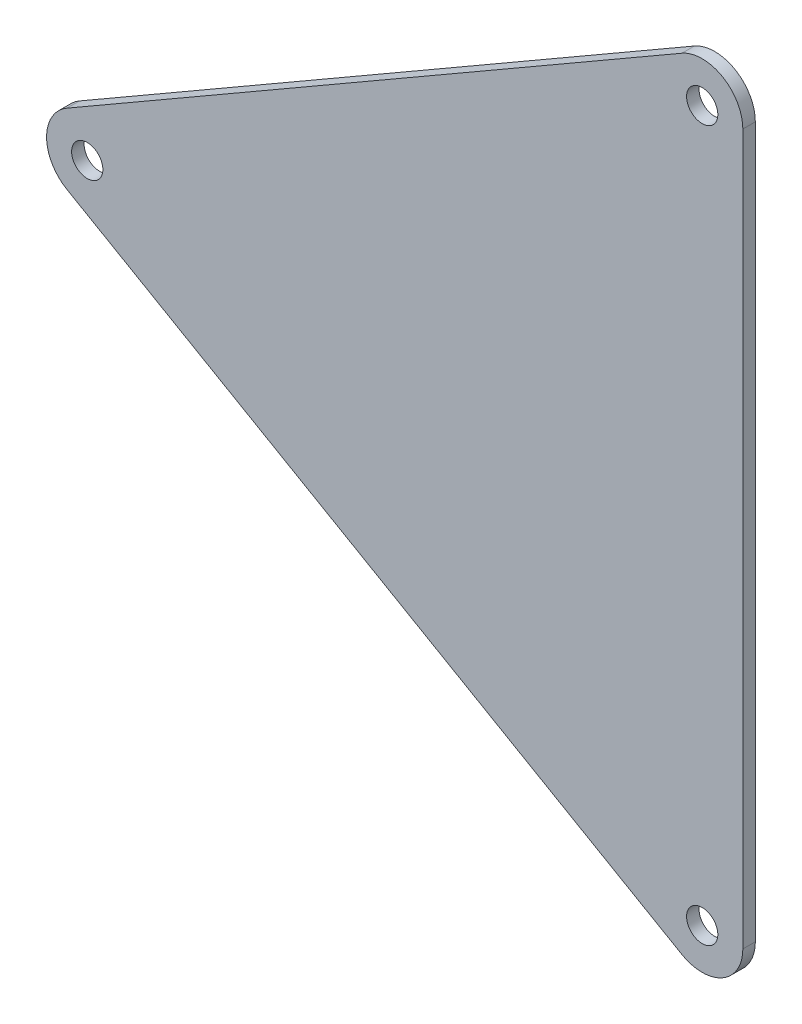
from build123d import *

# Parameters (mm, degrees)
SKETCH1_R           = 2.5
BOSS_EXTRUDE2_DEPTH = 2


with BuildPart() as part:
    # Sketch1 → Boss-Extrude2 (new body)
    with BuildSketch(Plane.XY):
        with BuildLine():
            Line((245.25, -5.629165125), (343.630404909, -62.429118382))
            ThreePointArc((343.630404909, -62.429118382), (350.130404909, -62.429118382), (353.380404909, -56.799953257))
            Line((353.380404909, -56.799953257), (353.380404909, 56.799953257))
            ThreePointArc((353.380404909, 56.799953257), (350.130404909, 62.429118382), (343.630404909, 62.429118382))
            Line((343.630404909, 62.429118382), (245.25, 5.629165125))
            ThreePointArc((245.25, 5.629165125), (242, 0), (245.25, -5.629165125))
        make_face()
        with Locations((248.5, 0)):
            Circle(SKETCH1_R, mode=Mode.SUBTRACT)
        with Locations((346.880404909, -56.799953257)):
            Circle(SKETCH1_R, mode=Mode.SUBTRACT)
        with Locations((346.880404909, 56.799953257)):
            Circle(SKETCH1_R, mode=Mode.SUBTRACT)
    extrude(amount=BOSS_EXTRUDE2_DEPTH)


solid = part.part
